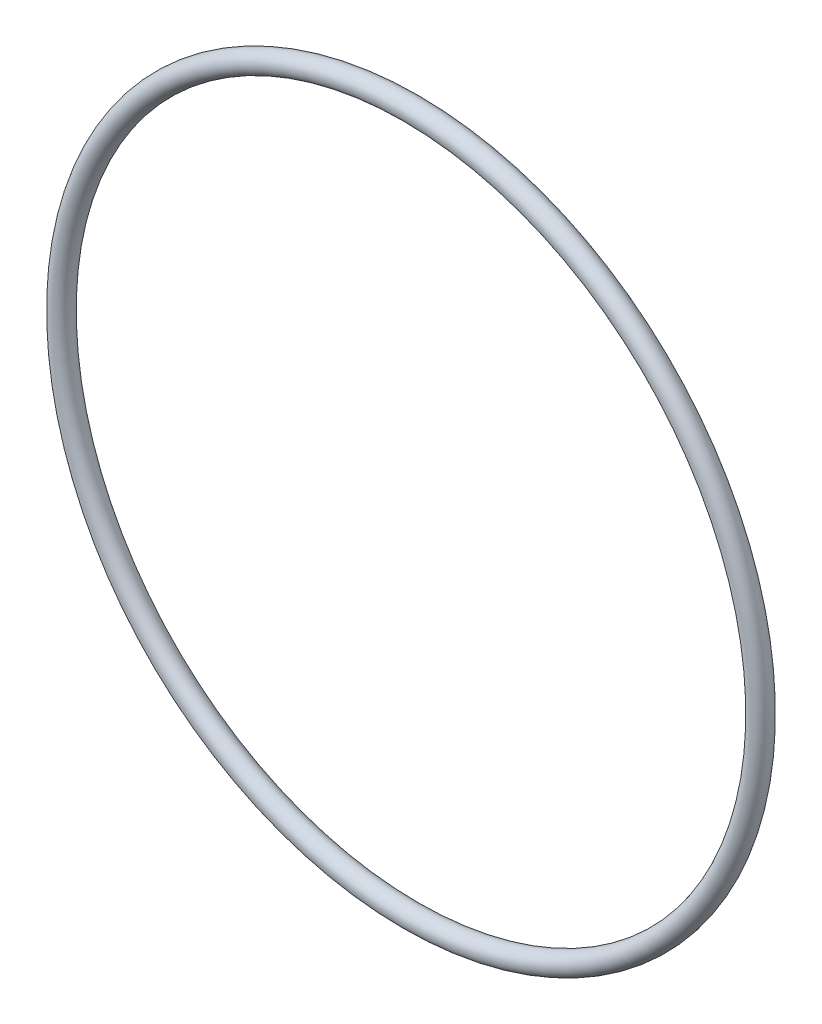
from build123d import *

# Parameters (mm, degrees)
SKETCH2_R = 1.5


with BuildPart() as part:
    # Sweep1: sweep along a path in Sketch1
    with BuildLine(Plane.XY) as sweep1_path:
        CenterArc((0, 0), 50.75, 0, 360)
    # Sketch2 → Sweep1 (sweep)
    with BuildSketch(Plane(origin=(0, 0, 0), x_dir=(0, 0, -1), z_dir=(1, 0, 0))):
        with Locations((0, 50)):
            Circle(SKETCH2_R)
    sweep(path=sweep1_path.line)


solid = part.part
